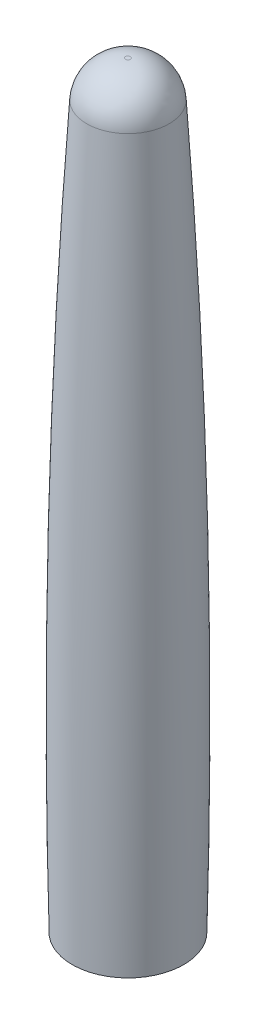
from build123d import *


with BuildPart() as part:
    # Sketch1 → Revolve2 (revolve)
    with BuildSketch(Plane.XY):
        with BuildLine():
            add(Edge.make_bspline(
                [(-3.245027372, 35.20847205), (-5.582759596, -1.861899074), (-4.75, -39.000000002)],
                knots=[0, 0, 0, 1, 1, 1], degree=2))
            Line((-4.75, -39.000000002), (-5.75, -39.000000002))
            add(Edge.make_bspline(
                [(-4.244358175, 35.251611633), (-4.98461298, 23.506704104), (-6.041246729, -1.232532761), (-6.041261547, -25.994444167), (-5.75, -39.000000002)],
                knots=[0.048102312, 0.048102312, 0.048102312, 0.048102312, 0.500240505, 1, 1, 1, 1], degree=3))
            ThreePointArc((-4.244358175, 35.251611633), (-2.99030381, 37.916028681), (-0.252279571, 39))
            Line((-0.252279571, 39), (0, 39))
            Line((0, 39), (0, 38))
            Line((0, 38), (-0.252279571, 38))
            ThreePointArc((-0.252279571, 38), (-2.298566922, 37.193788521), (-3.245027372, 35.20847205))
        make_face()
    revolve(axis=Axis((0, 39, 0), (0, -1, 0)))


solid = part.part
